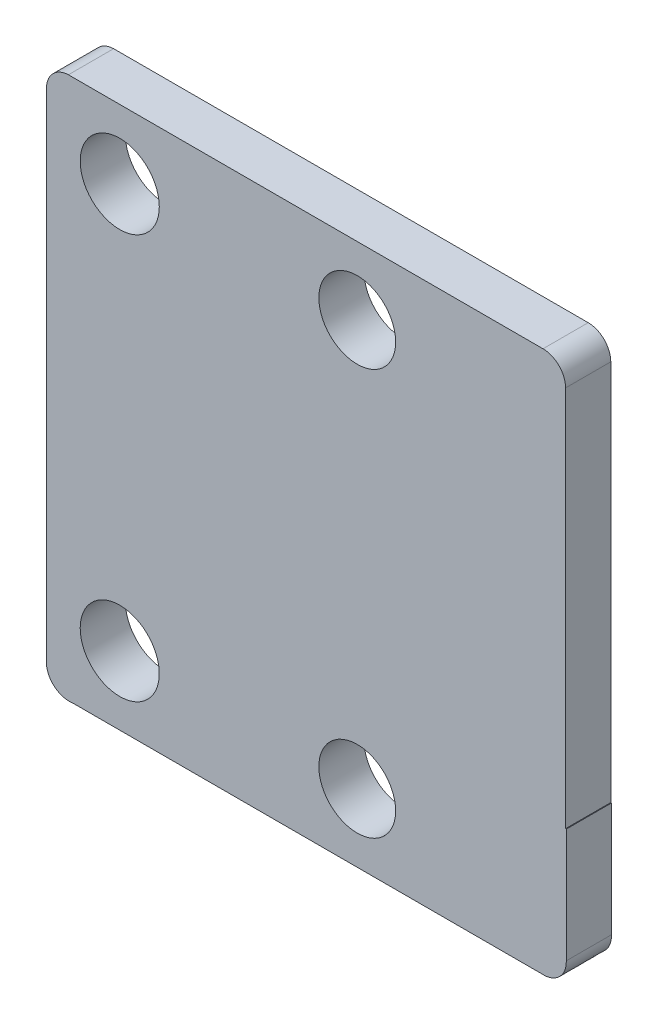
from build123d import *

# Parameters (mm, degrees)
SKETCH1_R           = 1.75
SKETCH1_R_2         = 1.7
BOSS_EXTRUDE1_DEPTH = 2


with BuildPart() as part:
    # Sketch1 → Boss-Extrude1 (new body)
    with BuildSketch(Plane.XY):
        with BuildLine():
            Line((4.131111122, 75.901391956), (25.032343796, 75.901377896))
            add(Edge.make_bspline(
                [(25.032343796, 75.901377896), (25.297692054, 75.90975298), (25.553711765, 76.028856816), (25.820691784, 76.317696861), (25.890807327, 76.431822393), (25.982618937, 76.678782523), (26.004172908, 76.809695074), (25.999986548, 76.942331771)],
                knots=[0, 0, 0, 0, 0.5, 0.5, 0.75, 0.75, 1, 1, 1, 1], degree=3))
            Line((25.999986548, 76.942331771), (25.999989945, 81.991990504))
            Line((25.999989945, 81.991990504), (25.969599942, 81.991985956))
            Line((25.969599942, 81.991985956), (25.969599942, 98.882300825))
            ThreePointArc((25.969599942, 98.882300825), (25.676706723, 99.589407606), (24.969599942, 99.882300825))
            Line((24.969599942, 99.882300825), (3.969599942, 99.882300825))
            ThreePointArc((3.969599942, 99.882300825), (3.282219087, 99.579042106), (2.999989942, 98.882762708))
            Line((2.999989942, 98.882762708), (2.999989942, 81.988548625))
            Line((2.999989942, 81.988548625), (2.999986426, 76.761900171))
            add(Edge.make_bspline(
                [(2.999986426, 76.761900171), (3.018498442, 76.630517465), (3.062890006, 76.50357159), (3.194804967, 76.27757553), (3.283868214, 76.176461233), (3.492056184, 76.01738597), (3.61249117, 75.958146472), (3.866997461, 75.89099095), (3.999692385, 75.882874863), (4.131111122, 75.901391956)],
                knots=[0, 0, 0, 0, 0.25, 0.25, 0.5, 0.5, 0.75, 0.75, 1, 1, 1, 1], degree=3))
        make_face()
        with Locations(Location((6.240524228, 78.941533895, 0), (0, 0, 180))):
            Circle(SKETCH1_R, mode=Mode.SUBTRACT)
        with Locations((16.749987873, 78.911635363)):
            Circle(SKETCH1_R_2, mode=Mode.SUBTRACT)
        with Locations((16.749999958, 96.877378149)):
            Circle(SKETCH1_R_2, mode=Mode.SUBTRACT)
        with Locations((6.240524228, 96.835747978)):
            Circle(SKETCH1_R, mode=Mode.SUBTRACT)
    extrude(amount=BOSS_EXTRUDE1_DEPTH)


solid = part.part
